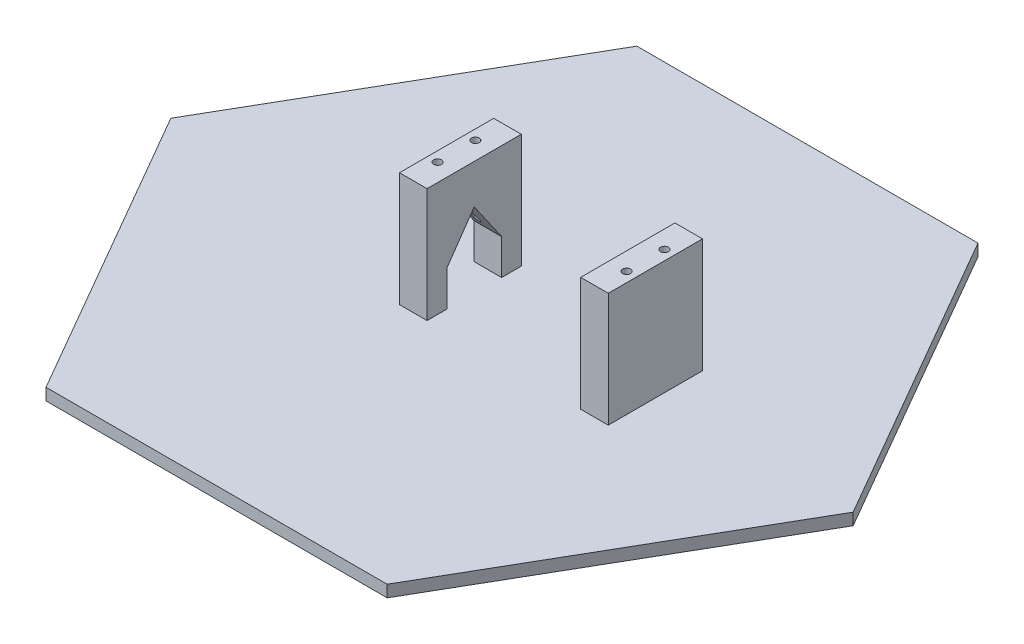
from build123d import *

# Parameters (mm, degrees)
BOSS_EXTRUDE1_DEPTH = 3
SKETCH2_R           = 1
SKETCH2_W           = 7
SKETCH2_H           = 23.92041254
SKETCH2_H_2         = 5
BOSS_EXTRUDE4_DEPTH = 29
BOSS_EXTRUDE5_DEPTH = 7
SKETCH2_4_R         = 1
CUT_EXTRUDE1_DEPTH  = 29


with BuildPart() as part:
    # Sketch1 → Boss-Extrude1 (new body)
    with BuildSketch(Plane(origin=(0, 0, 0), x_dir=(1, 0, 0), z_dir=(0, 1, 0))):
        Polygon((86.602540378, 0), (43.301270189, 75), (-43.301270189, 75), (-86.602540378, 0), (-43.301270189, -75), (43.301270189, -75), align=None)
    extrude(amount=BOSS_EXTRUDE1_DEPTH)

    # Sketch2 → Boss-Extrude4 (add)
    # profile 1 of 5: a face of its own
    with BuildSketch(Plane(origin=(0, 3, 0), x_dir=(1, 0, 0), z_dir=(0, 1, 0))):
        with Locations(Location((-14.1, -4.8, 0), (0, 0, 90))):
            Circle(SKETCH2_R)
    # profile 2 of 5: a face of its own
    with BuildSketch(Plane(origin=(0, 3, 0), x_dir=(1, 0, 0), z_dir=(0, 1, 0))):
        with Locations(Location((-14.1, 4.8, 0), (0, 0, 90))):
            Circle(SKETCH2_R)
    # profile 3 of 5: a face of its own
    with BuildSketch(Plane(origin=(0, 3, 0), x_dir=(1, 0, 0), z_dir=(0, 1, 0))):
        with Locations((32.9, 0)):
            Rectangle(SKETCH2_W, SKETCH2_H)
        with Locations(Location((33.9, -4.8, 0), (0, 0, 90))):
            Circle(SKETCH2_R, mode=Mode.SUBTRACT)
        with Locations(Location((33.9, 4.8, 0), (0, 0, 90))):
            Circle(SKETCH2_R, mode=Mode.SUBTRACT)
    # profile 4 of 5: a face of its own
    with BuildSketch(Plane(origin=(0, 3, 0), x_dir=(1, 0, 0), z_dir=(0, 1, 0))):
        with Locations((-13.1, 9.46020627)):
            Rectangle(SKETCH2_W, SKETCH2_H_2)
    # profile 5 of 5: a face of its own
    with BuildSketch(Plane(origin=(0, 3, 0), x_dir=(1, 0, 0), z_dir=(0, 1, 0))):
        with Locations((-13.1, -9.46020627)):
            Rectangle(SKETCH2_W, SKETCH2_H_2)
    extrude(amount=BOSS_EXTRUDE4_DEPTH)

    # Sketch4 → Boss-Extrude5 (add)
    with BuildSketch(Plane.ZY.offset(16.6)):
        Polygon((-6.96020627, 12), (0, 22), (6.96020627, 12), (6.96020627, 32), (-6.96020627, 32), align=None)
    extrude(amount=-BOSS_EXTRUDE5_DEPTH)

    # Sketch2<4> → Cut-Extrude1 (cut)
    with BuildSketch(Plane(origin=(0, 3, 0), x_dir=(1, 0, 0), z_dir=(0, 1, 0))):
        with Locations(Location((-14.1, -4.8, 0), (0, 0, 90))):
            Circle(SKETCH2_4_R)
        with Locations(Location((-14.1, 4.8, 0), (0, 0, 90))):
            Circle(SKETCH2_4_R)
    extrude(amount=CUT_EXTRUDE1_DEPTH, mode=Mode.SUBTRACT)


solid = part.part
